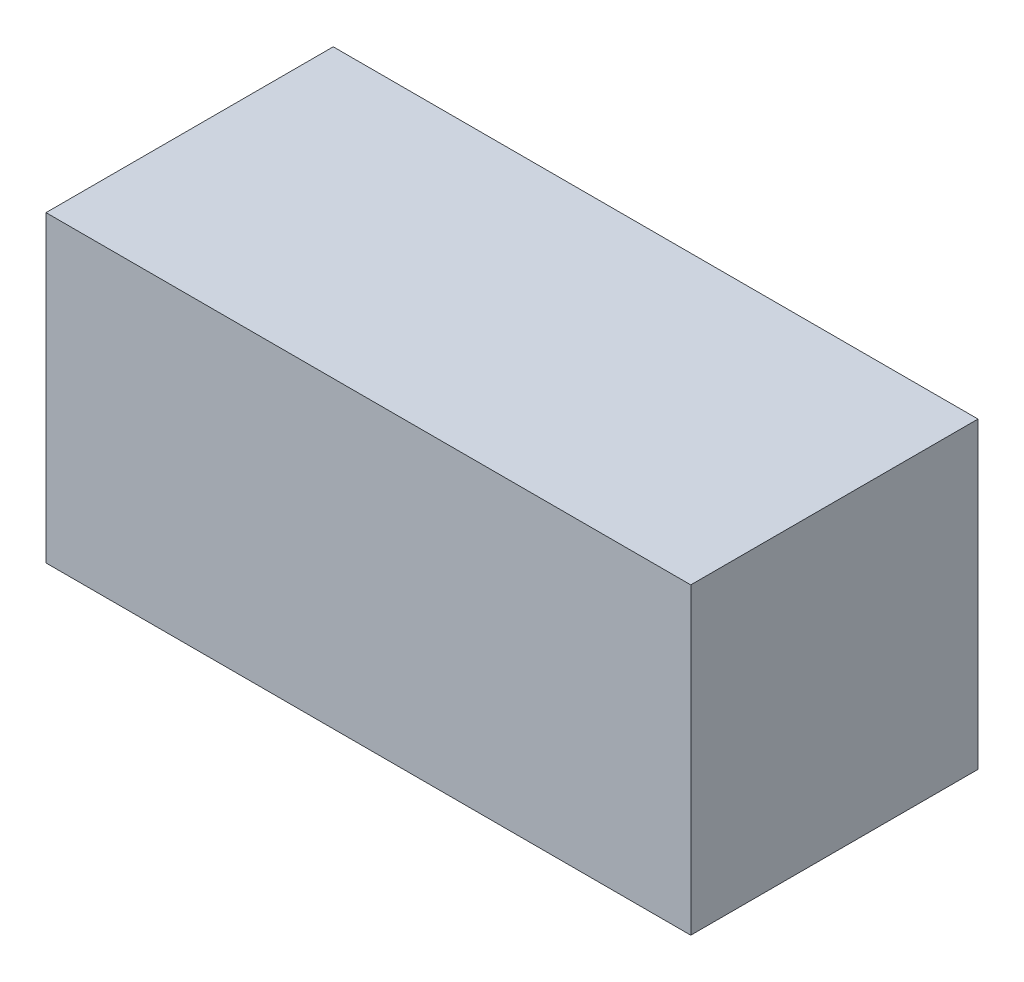
from build123d import *

# Parameters (mm, degrees)
SKETCH1_W           = 161.925
SKETCH1_H           = 76.2
BOSS_EXTRUDE1_DEPTH = 72.136


with BuildPart() as part:
    # Sketch1 → Boss-Extrude1 (new body)
    with BuildSketch(Plane.XY):
        Rectangle(SKETCH1_W, SKETCH1_H)
    extrude(amount=BOSS_EXTRUDE1_DEPTH)


solid = part.part
